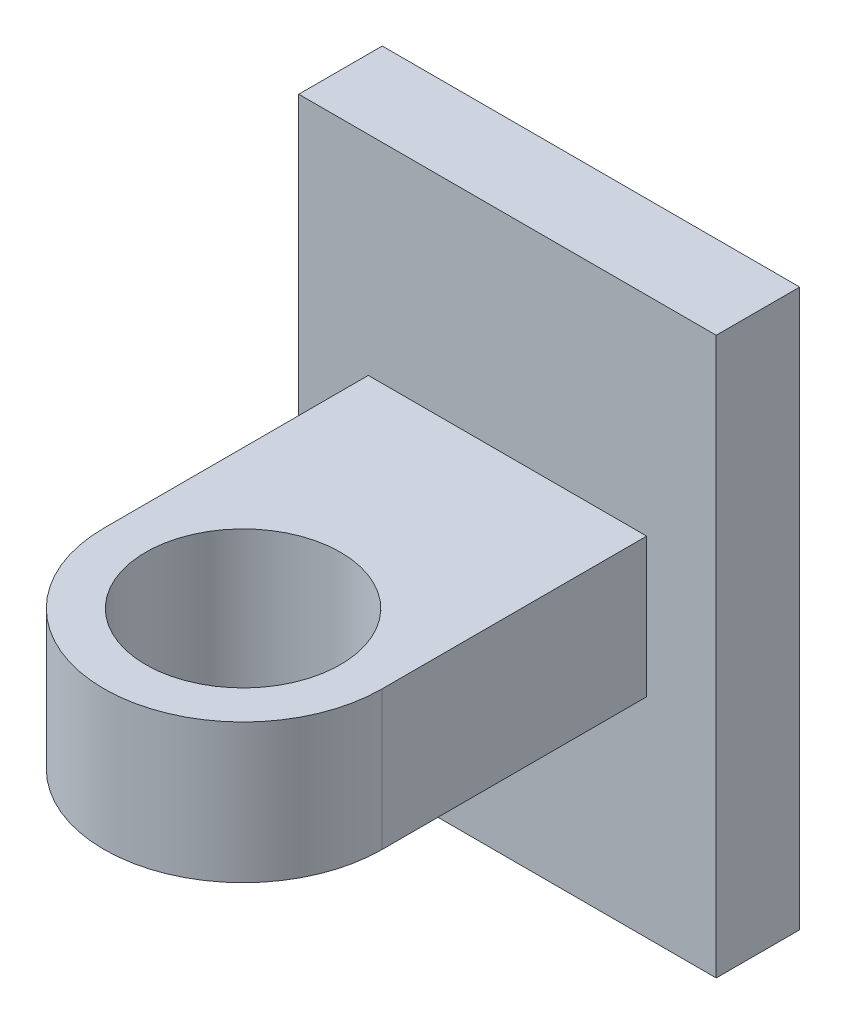
from build123d import *

# Parameters (mm, degrees)
SKETCH1_W           = 15
SKETCH1_H           = 20
BOSS_EXTRUDE2_DEPTH = 3
SKETCH2_R           = 3.5
BOSS_EXTRUDE3_DEPTH = 2.5


with BuildPart() as part:
    # Sketch1 → Boss-Extrude2 (new body)
    with BuildSketch(Plane.XY):
        Rectangle(SKETCH1_W, SKETCH1_H)
    extrude(amount=BOSS_EXTRUDE2_DEPTH)

    # Sketch2 → Boss-Extrude3 (add, symmetric)
    with BuildSketch(Plane(origin=(0, 0, 0), x_dir=(1, 0, 0), z_dir=(0, 1, 0))):
        with BuildLine():
            Line((-5, -3), (5, -3))
            Line((5, -3), (5, -12.5))
            ThreePointArc((5, -12.5), (0, -17.5), (-5, -12.5))
            Line((-5, -12.5), (-5, -3))
        make_face()
        with Locations(Location((0, -12.5, 0), (0, 0, 270))):
            Circle(SKETCH2_R, mode=Mode.SUBTRACT)
    extrude(amount=BOSS_EXTRUDE3_DEPTH, both=True)


solid = part.part
